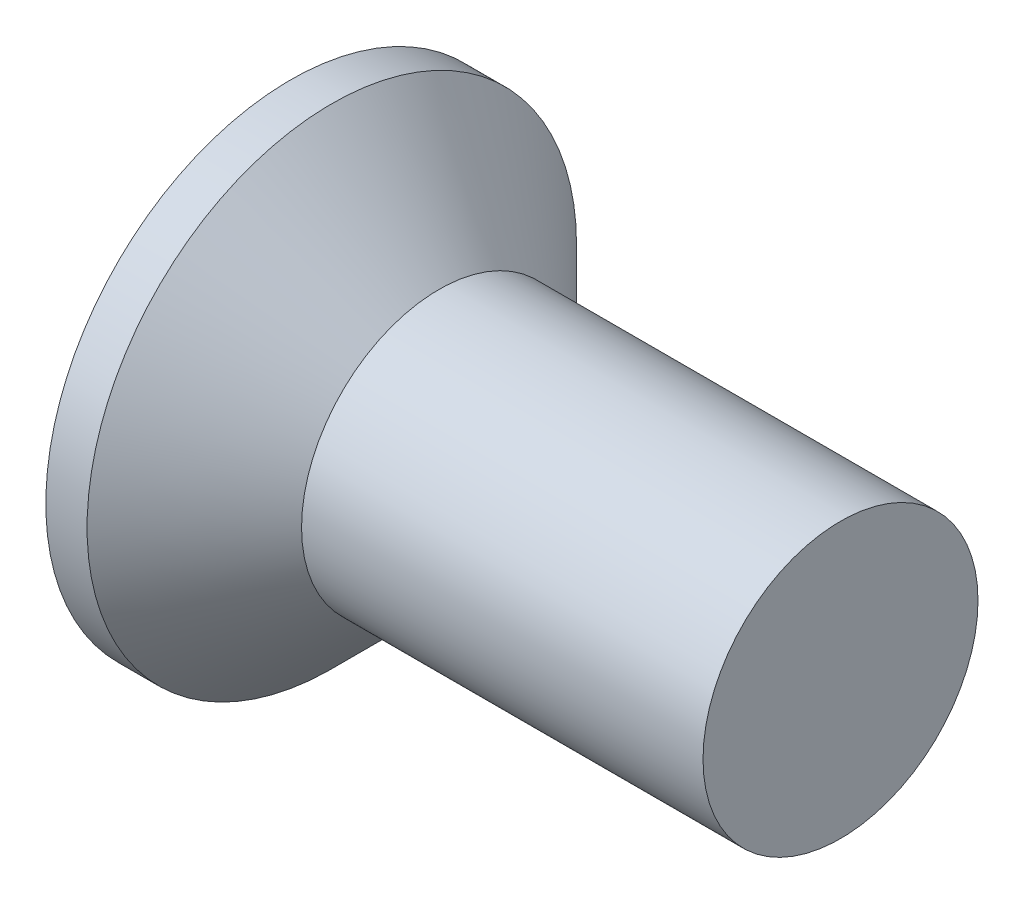
from build123d import *

# Parameters (mm, degrees)
CROSSRECESS_DEPTH = 1.35
DRAFT9_ANGLE      = 30
FILLET5_R         = 0.3
SKETCH10_W        = 0.8
SKETCH10_H        = 2.5


with BuildPart() as part:
    # Sketch1 → Base (revolve)
    with BuildSketch(Plane.XY, mode=Mode.PRIVATE) as base_sk:
        Polygon((10, 2.5), (4.3, 2.5), (2.7, 2.5), (0.75, 4.45), (0, 4.45), (0, 0), (10, 0), align=None)
    revolve(base_sk.sketch.rotate(Axis((4.515812911, 0, 0), (-1, 0, 0)), 90), axis=Axis((4.515812911, 0, 0), (-1, 0, 0)))

    # Sketch6 → CrossRecess (cut)
    with BuildSketch(Plane(origin=(0, 0, 0), x_dir=(0, 0, -1), z_dir=(1, 0, 0))):
        Polygon((0.52, 0.52), (0.52, 2.6), (-0.52, 2.6), (-0.52, 0.52), (-2.6, 0.52), (-2.6, -0.52), (-0.52, -0.52), (-0.52, -2.6), (0.52, -2.6), (0.52, -0.52), (2.6, -0.52), (2.6, 0.52), align=None)
    extrude(amount=CROSSRECESS_DEPTH, mode=Mode.SUBTRACT)

    # Draft9
    draft9_faces = [part.faces().sort_by_distance(p)[0] for p in [
        (0.675, -2.6, 0),
        (0.675, 0, 2.6),
        (0.675, 0, -2.6),
        (0.675, 2.6, 0),
    ]]
    draft(draft9_faces, Plane(origin=(0, 4.45, 0), x_dir=(0, 0, -1), z_dir=(-1, 0, 0)), DRAFT9_ANGLE)

    # Fillet5
    fillet5_edges = [part.edges().sort_by_distance(p)[0] for p in [
        (0.675, 0.52, 0.52),
        (0.675, -0.52, 0.52),
        (0.675, -0.52, -0.52),
        (0.675, 0.52, -0.52),
    ]]
    fillet(fillet5_edges, radius=FILLET5_R)

    # Sketch10 → Revolve2 (revolve)
    with BuildSketch(Plane.XY):
        with Locations((3.1, 1.25)):
            Rectangle(SKETCH10_W, SKETCH10_H)
    revolve(axis=Axis((62.228915663, 0, 0), (-1, 0, 0)))


solid = part.part
